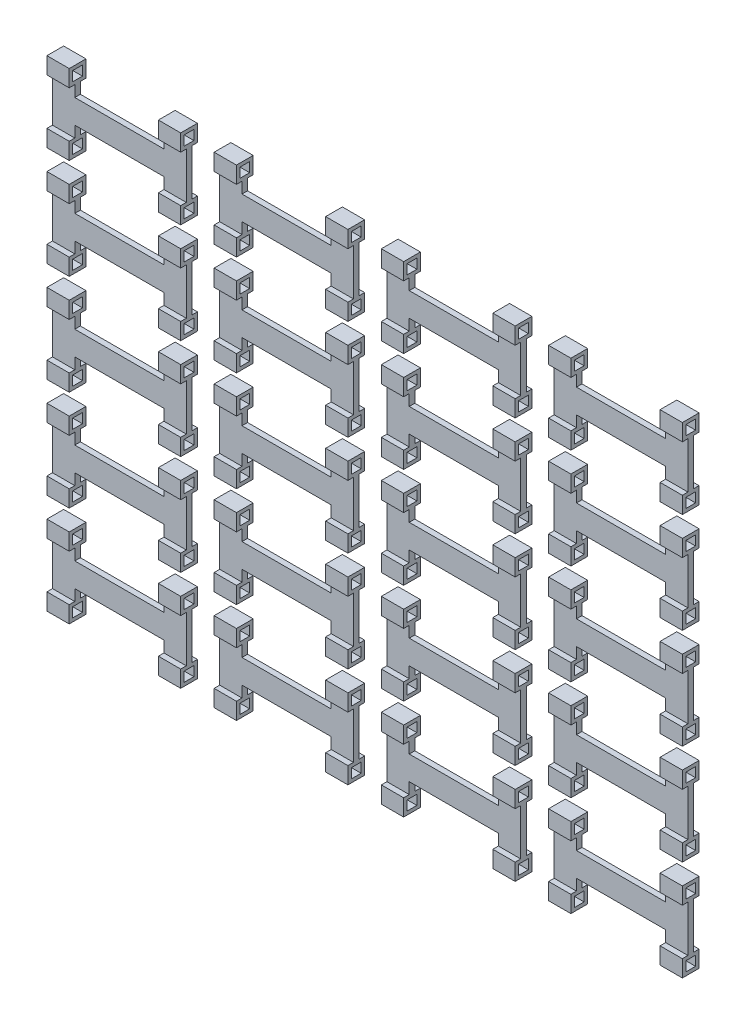
from build123d import *

# Parameters (mm, degrees)
SKETCH_1_W               = 1.74
SKETCH_1_H               = 1.74
SKETCH_1_W_2             = 3
SKETCH_1_H_2             = 3
EXTRUDE_1_DEPTH          = 24
CUT_EXTRUDE_1_DEPTH      = 28.241328896
CUT_EXTRUDE_1_DEPTH_BACK = 28.241328896
SKETCH_2_W               = 16
SKETCH_2_H               = 10
PATTERN_LINEAR_1_COUNT   = 5
PATTERN_LINEAR_1_PITCH   = 18
PATTERN_LINEAR_1_2_COUNT = 4
PATTERN_LINEAR_1_2_PITCH = 30


with BuildPart() as part:
    # 草图1 → 凸台-拉伸1 (new body)
    # profile 1 of 2: a face of its own
    with BuildSketch(Plane(origin=(0, 0, 0), x_dir=(0, 0, -1), z_dir=(1, 0, 0))):
        Polygon((0.5, 1.5), (0.5, 9.8), (1.5, 9.8), (1.5, 12.8), (-1.5, 12.8), (-1.5, 9.8), (-0.5, 9.8), (-0.5, 1.5), align=None)
        with Locations((0, 11.3)):
            Rectangle(SKETCH_1_W, SKETCH_1_H, mode=Mode.SUBTRACT)
    # profile 2 of 2: a face of its own
    with BuildSketch(Plane(origin=(0, 0, 0), x_dir=(0, 0, -1), z_dir=(1, 0, 0))):
        Rectangle(SKETCH_1_W_2, SKETCH_1_H_2)
        Rectangle(SKETCH_1_W, SKETCH_1_H, mode=Mode.SUBTRACT)
    extrude(amount=EXTRUDE_1_DEPTH)

    # 草图2 → 切除-拉伸1 (cut, two sides: drawn at the far end of the back side and taken through both)
    with BuildSketch(Plane.XY.offset(-CUT_EXTRUDE_1_DEPTH_BACK)):
        with Locations((12, 12.8)):
            Rectangle(SKETCH_2_W, SKETCH_2_H)
        with Locations((12, -1.5)):
            Rectangle(SKETCH_2_W, SKETCH_2_H)
    extrude(amount=CUT_EXTRUDE_1_DEPTH + CUT_EXTRUDE_1_DEPTH_BACK, mode=Mode.SUBTRACT)


with BuildPart() as pattern_linear_1_1:
    # 阵列(线性)1: pattern copy
    add(part.part.moved(Location(Vector(0, -1, 0) * (1 * PATTERN_LINEAR_1_PITCH))))


with BuildPart() as pattern_linear_1_2:
    # 阵列(线性)1: pattern copy
    add(part.part.moved(Location(Vector(0, -1, 0) * (2 * PATTERN_LINEAR_1_PITCH))))


with BuildPart() as pattern_linear_1_3:
    # 阵列(线性)1: pattern copy
    add(part.part.moved(Location(Vector(0, -1, 0) * (3 * PATTERN_LINEAR_1_PITCH))))


with BuildPart() as pattern_linear_1_4:
    # 阵列(线性)1: pattern copy
    add(part.part.moved(Location(Vector(0, -1, 0) * (4 * PATTERN_LINEAR_1_PITCH))))


with BuildPart() as pattern_linear_1_2_1:
    # Pattern Linear 1 2: pattern copy
    add(part.part.moved(Location(Vector(-1, 0, 0) * (1 * PATTERN_LINEAR_1_2_PITCH))))


with BuildPart() as pattern_linear_1_2_2:
    # Pattern Linear 1 2: pattern copy
    add(part.part.moved(Location(Vector(-1, 0, 0) * (2 * PATTERN_LINEAR_1_2_PITCH))))


with BuildPart() as pattern_linear_1_2_3:
    # Pattern Linear 1 2: pattern copy
    add(part.part.moved(Location(Vector(-1, 0, 0) * (3 * PATTERN_LINEAR_1_2_PITCH))))


with BuildPart() as pattern_linear_1_2_4:
    # Pattern Linear 1 2: pattern copy
    add(pattern_linear_1_1.part.moved(Location(Vector(-1, 0, 0) * (1 * PATTERN_LINEAR_1_2_PITCH))))


with BuildPart() as pattern_linear_1_2_5:
    # Pattern Linear 1 2: pattern copy
    add(pattern_linear_1_1.part.moved(Location(Vector(-1, 0, 0) * (2 * PATTERN_LINEAR_1_2_PITCH))))


with BuildPart() as pattern_linear_1_2_6:
    # Pattern Linear 1 2: pattern copy
    add(pattern_linear_1_1.part.moved(Location(Vector(-1, 0, 0) * (3 * PATTERN_LINEAR_1_2_PITCH))))


with BuildPart() as pattern_linear_1_2_7:
    # Pattern Linear 1 2: pattern copy
    add(pattern_linear_1_2.part.moved(Location(Vector(-1, 0, 0) * (1 * PATTERN_LINEAR_1_2_PITCH))))


with BuildPart() as pattern_linear_1_2_8:
    # Pattern Linear 1 2: pattern copy
    add(pattern_linear_1_2.part.moved(Location(Vector(-1, 0, 0) * (2 * PATTERN_LINEAR_1_2_PITCH))))


with BuildPart() as pattern_linear_1_2_9:
    # Pattern Linear 1 2: pattern copy
    add(pattern_linear_1_2.part.moved(Location(Vector(-1, 0, 0) * (3 * PATTERN_LINEAR_1_2_PITCH))))


with BuildPart() as pattern_linear_1_2_10:
    # Pattern Linear 1 2: pattern copy
    add(pattern_linear_1_3.part.moved(Location(Vector(-1, 0, 0) * (1 * PATTERN_LINEAR_1_2_PITCH))))


with BuildPart() as pattern_linear_1_2_11:
    # Pattern Linear 1 2: pattern copy
    add(pattern_linear_1_3.part.moved(Location(Vector(-1, 0, 0) * (2 * PATTERN_LINEAR_1_2_PITCH))))


with BuildPart() as pattern_linear_1_2_12:
    # Pattern Linear 1 2: pattern copy
    add(pattern_linear_1_3.part.moved(Location(Vector(-1, 0, 0) * (3 * PATTERN_LINEAR_1_2_PITCH))))


with BuildPart() as pattern_linear_1_2_13:
    # Pattern Linear 1 2: pattern copy
    add(pattern_linear_1_4.part.moved(Location(Vector(-1, 0, 0) * (1 * PATTERN_LINEAR_1_2_PITCH))))


with BuildPart() as pattern_linear_1_2_14:
    # Pattern Linear 1 2: pattern copy
    add(pattern_linear_1_4.part.moved(Location(Vector(-1, 0, 0) * (2 * PATTERN_LINEAR_1_2_PITCH))))


with BuildPart() as pattern_linear_1_2_15:
    # Pattern Linear 1 2: pattern copy
    add(pattern_linear_1_4.part.moved(Location(Vector(-1, 0, 0) * (3 * PATTERN_LINEAR_1_2_PITCH))))


solid = Compound([part.part, pattern_linear_1_1.part, pattern_linear_1_2.part, pattern_linear_1_3.part, pattern_linear_1_4.part, pattern_linear_1_2_1.part, pattern_linear_1_2_2.part, pattern_linear_1_2_3.part, pattern_linear_1_2_4.part, pattern_linear_1_2_5.part, pattern_linear_1_2_6.part, pattern_linear_1_2_7.part, pattern_linear_1_2_8.part, pattern_linear_1_2_9.part, pattern_linear_1_2_10.part, pattern_linear_1_2_11.part, pattern_linear_1_2_12.part, pattern_linear_1_2_13.part, pattern_linear_1_2_14.part, pattern_linear_1_2_15.part])
